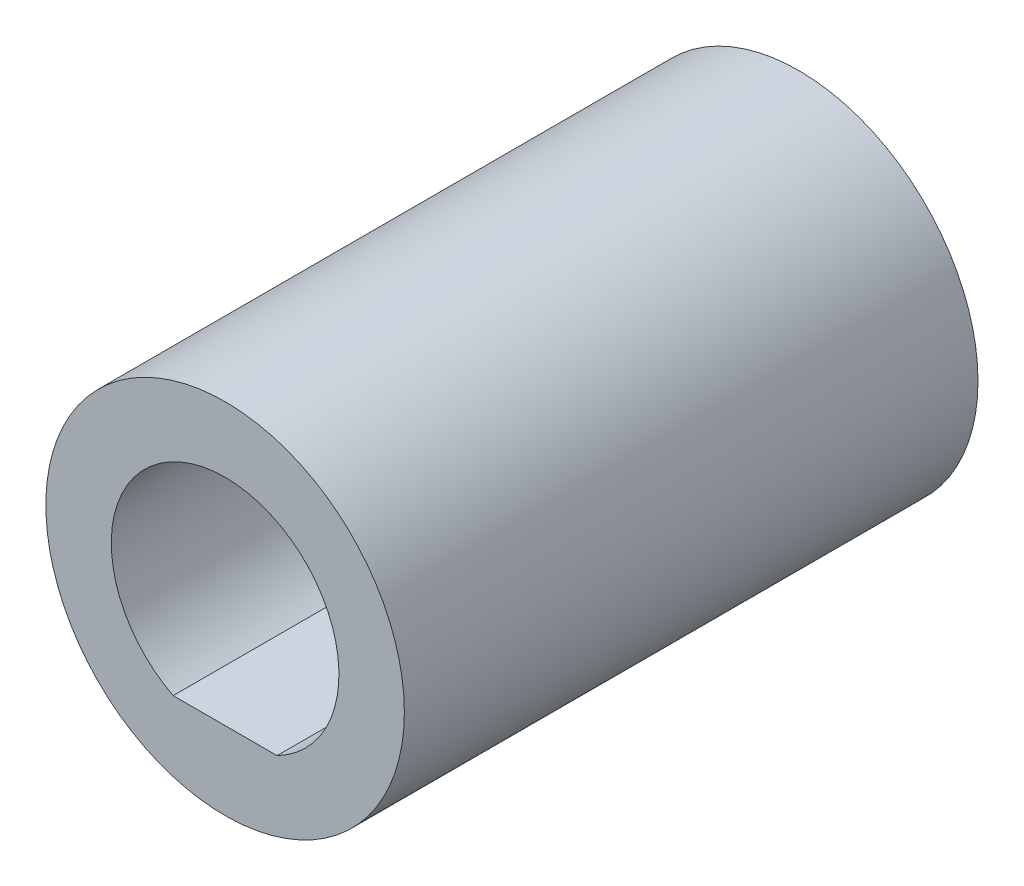
from build123d import *

# Parameters (mm, degrees)
SKETCH1_R           = 2.5
BOSS_EXTRUDE4_DEPTH = 8


with BuildPart() as part:
    # Sketch1 → Boss-Extrude4 (new body)
    with BuildSketch(Plane.XY):
        Circle(SKETCH1_R)
        with BuildLine():
            Line((0.724568837, -1.4125), (-0.724568837, -1.4125))
            ThreePointArc((-0.724568837, -1.4125), (0, 1.5875), (0.724568837, -1.4125))
        make_face(mode=Mode.SUBTRACT)
    extrude(amount=BOSS_EXTRUDE4_DEPTH)


solid = part.part
